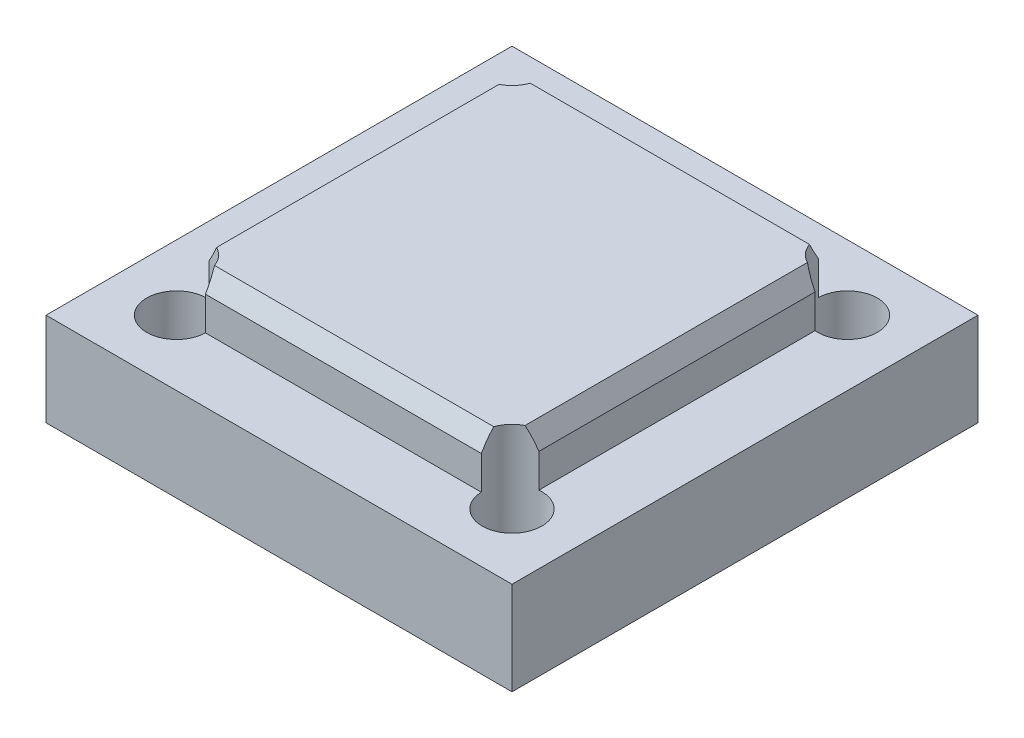
from build123d import *
from OCP.BRepFilletAPI import BRepFilletAPI_MakeChamfer

# Parameters (mm, degrees)
SKETCH1_W               = 25
SKETCH1_H               = 25
BOSS_EXTRUDE1_DEPTH     = 5
SKETCH4_R               = 4.15
CUT_EXTRUDE2_DEPTH      = 19.371173071
SKETCH9_W               = 17.7
SKETCH9_H               = 18.092678694
BOSS_EXTRUDE3_DEPTH     = 2.8
CUT_EXTRUDE4_DEPTH      = 19.371173071
CUT_EXTRUDE4_DEPTH_BACK = 19.371173071
SKETCH6_R               = 1.6
CHAMFER1_SIZE           = 1
CHAMFER1_SIZE2          = 0.577350269
SKETCH10_R              = 4.15
BOSS_EXTRUDE4_DEPTH     = 5


with BuildPart() as part:
    # Sketch1 → Boss-Extrude1 (new body)
    with BuildSketch(Plane(origin=(0, 0, 0), x_dir=(1, 0, 0), z_dir=(0, 1, 0))):
        Rectangle(SKETCH1_W, SKETCH1_H)
    extrude(amount=BOSS_EXTRUDE1_DEPTH)

    # Sketch4 → Cut-Extrude2 (cut, through all)
    with BuildSketch(Plane(origin=(0, 5, 0), x_dir=(1, 0, 0), z_dir=(0, 1, 0))):
        with Locations(Location((0, 0, 0), (0, 0, 270))):
            Circle(SKETCH4_R)
    extrude(amount=-CUT_EXTRUDE2_DEPTH, mode=Mode.SUBTRACT)

    # Sketch9 → Boss-Extrude3 (add)
    with BuildSketch(Plane(origin=(0, 5, 0), x_dir=(1, 0, 0), z_dir=(0, 1, 0))):
        Rectangle(SKETCH9_W, SKETCH9_H)
    extrude(amount=BOSS_EXTRUDE3_DEPTH)

    # Sketch6 → Cut-Extrude4 (cut, two sides: drawn at the far end of the back side and taken through both)
    with BuildSketch(Plane(origin=(0, 5, 0), x_dir=(1, 0, 0), z_dir=(0, 1, 0)).offset(-CUT_EXTRUDE4_DEPTH_BACK)):
        with Locations(Location((9, -9, 0), (0, 0, 270))):
            Circle(SKETCH6_R)
        with Locations(Location((-9, -9, 0), (0, 0, 270))):
            Circle(SKETCH6_R)
        with Locations(Location((-9, 9, 0), (0, 0, 270))):
            Circle(SKETCH6_R)
        with Locations(Location((9, 9, 0), (0, 0, 270))):
            Circle(SKETCH6_R)
    extrude(amount=CUT_EXTRUDE4_DEPTH + CUT_EXTRUDE4_DEPTH_BACK, mode=Mode.SUBTRACT)

    # Chamfer1: one chamfer whose edges measure the first distance from different faces: ONE call of the kernel's chamfer builder (chamfer() names one face for all edges)
    chamfer1_edges_1 = [part.edges().sort_by_distance(p)[0] for p in [
        (8.85, 7.8, 0),
    ]]
    chamfer1_side_1 = [part.faces().sort_by_distance(p)[0] for p in [
        (8.85, 6.4, 0),
    ]]
    chamfer1_edges_2 = [part.edges().sort_by_distance(p)[0] for p in [
        (0, 7.8, 9.046339347),
    ]]
    chamfer1_side_2 = [part.faces().sort_by_distance(p)[0] for p in [
        (0, 6.4, 9.046339347),
    ]]
    chamfer1_edges_3 = [part.edges().sort_by_distance(p)[0] for p in [
        (0, 7.8, -9.046339347),
    ]]
    chamfer1_side_3 = [part.faces().sort_by_distance(p)[0] for p in [
        (0, 6.4, -9.046339347),
    ]]
    chamfer1_edges_4 = [part.edges().sort_by_distance(p)[0] for p in [
        (-8.85, 7.8, 0),
    ]]
    chamfer1_side_4 = [part.faces().sort_by_distance(p)[0] for p in [
        (-8.85, 6.4, 0),
    ]]
    chamfer1 = BRepFilletAPI_MakeChamfer(part.part.solid().wrapped)
    for e in chamfer1_edges_1:
        chamfer1.Add(CHAMFER1_SIZE, CHAMFER1_SIZE2, e.wrapped, chamfer1_side_1[0].wrapped)  # the first distance lies on this face
    for e in chamfer1_edges_2:
        chamfer1.Add(CHAMFER1_SIZE, CHAMFER1_SIZE2, e.wrapped, chamfer1_side_2[0].wrapped)  # the first distance lies on this face
    for e in chamfer1_edges_3:
        chamfer1.Add(CHAMFER1_SIZE, CHAMFER1_SIZE2, e.wrapped, chamfer1_side_3[0].wrapped)  # the first distance lies on this face
    for e in chamfer1_edges_4:
        chamfer1.Add(CHAMFER1_SIZE, CHAMFER1_SIZE2, e.wrapped, chamfer1_side_4[0].wrapped)  # the first distance lies on this face
    add(Compound.cast(chamfer1.Shape()), mode=Mode.REPLACE)

    # Sketch10 → Boss-Extrude4 (add)
    with BuildSketch(Plane.XZ.offset(-5)):
        Circle(SKETCH10_R)
    extrude(amount=BOSS_EXTRUDE4_DEPTH)


solid = part.part
